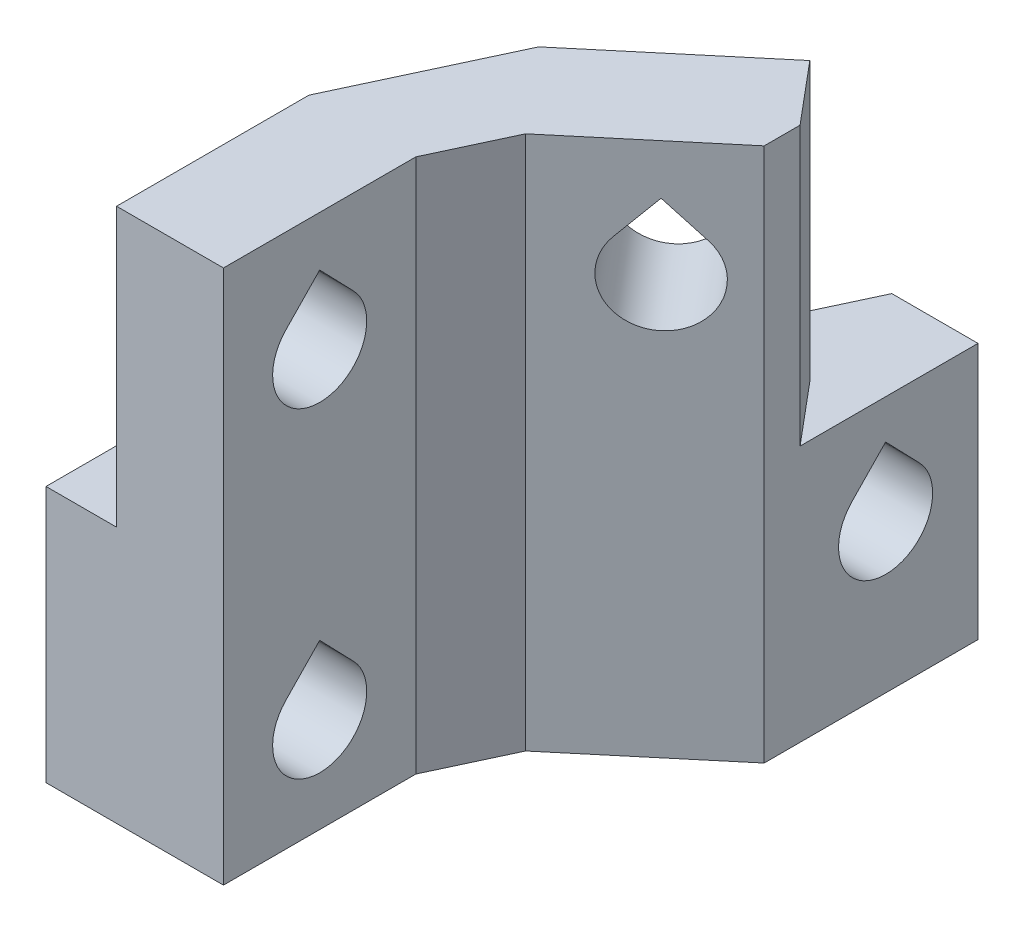
from build123d import *

# Parameters (mm, degrees)
BOSS_EXTRUDE1_DEPTH = 12
BOSS_EXTRUDE2_DEPTH = 13
SKETCH3_W           = 9
SKETCH3_H           = 12
BOSS_EXTRUDE3_DEPTH = 3.3
CUT_EXTRUDE1_DEPTH  = 34.256578297
CUT_EXTRUDE2_DEPTH  = 25.143114961
CUT_EXTRUDE3_DEPTH  = 25.143114961
CUT_EXTRUDE4_DEPTH  = 28.6007146
CUT_EXTRUDE5_DEPTH  = 28.748873851
CHAMFER1_SIZE       = 2.129646437


with BuildPart() as part:
    # Sketch1 → Boss-Extrude1 (new body)
    with BuildSketch(Plane.XZ.offset(17)):
        Polygon((16, 15), (3.3, 15), (3.3, 6), (11.968992121, -12.590713597), (16, -12.590713597), align=None)
    extrude(amount=-BOSS_EXTRUDE1_DEPTH)

    # Sketch2 → Boss-Extrude2 (add)
    with BuildSketch(Plane(origin=(0, -5, 0), x_dir=(-1, 0, 0), z_dir=(0, 1, 0))):
        Polygon((-16, 15), (-3.3, 15), (-3.3, 6), (-6.717465771, -1.328778996), (-13.611865759, -7.113867483), (-16, -4.267799921), align=None)
    extrude(amount=BOSS_EXTRUDE2_DEPTH)

    # Sketch3 → Boss-Extrude3 (add)
    with BuildSketch(Plane.ZY.offset(-3.3)):
        with Locations((10.5, -11)):
            Rectangle(SKETCH3_W, SKETCH3_H)
    extrude(amount=BOSS_EXTRUDE3_DEPTH)

    # Sketch4 → Cut-Extrude1 (cut, through all)
    with BuildSketch(Plane.XZ.offset(17)):
        Polygon((16, 15), (8.3, 15), (8.3, 3.870353563), (16, -2.590713597), align=None)
    extrude(amount=-CUT_EXTRUDE1_DEPTH, mode=Mode.SUBTRACT)

    # Sketch5 → Cut-Extrude2 (cut, through all)
    with BuildSketch(Plane(origin=(8.3, 0, 0), x_dir=(0, 0, -1), z_dir=(1, 0, 0))):
        with BuildLine():
            Line((-8.917452439, -10.971751585), (-10.5, -9.332975613))
            Line((-10.5, -9.332975613), (-12.082547561, -10.971751585))
            ThreePointArc((-12.082547561, -10.971751585), (-10.5, -14.7), (-8.917452439, -10.971751585))
        make_face()
    extrude(amount=-CUT_EXTRUDE2_DEPTH, mode=Mode.SUBTRACT)

    # Sketch6 → Cut-Extrude3 (cut, through all)
    with BuildSketch(Plane(origin=(8.3, 0, 0), x_dir=(0, 0, -1), z_dir=(1, 0, 0))):
        with BuildLine():
            Line((-8.917452439, 4.028248415), (-10.5, 5.667024387))
            Line((-10.5, 5.667024387), (-12.082547561, 4.028248415))
            ThreePointArc((-12.082547561, 4.028248415), (-10.5, 0.3), (-8.917452439, 4.028248415))
        make_face()
    extrude(amount=-CUT_EXTRUDE3_DEPTH, mode=Mode.SUBTRACT)

    # Sketch7 → Cut-Extrude4 (cut, through all)
    with BuildSketch(Plane(origin=(5.33513716, 0, 6.358168878), x_dir=(0.766044443118978, 0, -0.6427876096865394), z_dir=(0.6427876096865394, 0, 0.766044443118978))):
        with BuildLine():
            Line((12.082582782, 4.028248415), (10.500035221, 5.667024387))
            Line((10.500035221, 5.667024387), (8.91748766, 4.028248415))
            ThreePointArc((8.91748766, 4.028248415), (10.500035221, 0.3), (12.082582782, 4.028248415))
        make_face()
    extrude(amount=-CUT_EXTRUDE4_DEPTH, mode=Mode.SUBTRACT)

    # Sketch8 → Cut-Extrude5 (cut, through all)
    with BuildSketch(Plane(origin=(16, 0, 0), x_dir=(0, 0, -1), z_dir=(1, 0, 0))):
        with BuildLine():
            Line((9.852318341, -8.471751585), (8.26977078, -6.832975613))
            Line((8.26977078, -6.832975613), (6.68722322, -8.471751585))
            ThreePointArc((6.68722322, -8.471751585), (8.26977078, -12.2), (9.852318341, -8.471751585))
        make_face()
    extrude(amount=-CUT_EXTRUDE5_DEPTH, mode=Mode.SUBTRACT)

    # Chamfer1
    chamfer1_edges = [part.edges().sort_by_distance(p)[0] for p in [
        (8.3, -4.5, 3.870353563),
    ]]
    chamfer(chamfer1_edges, length=CHAMFER1_SIZE)


solid = part.part
